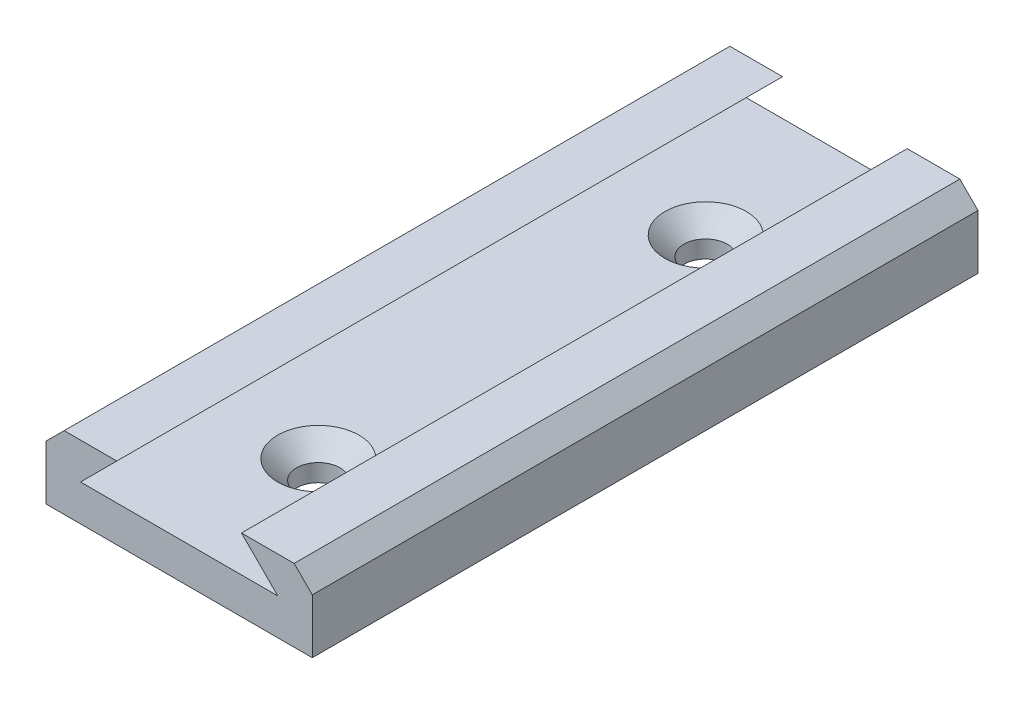
from build123d import *

# Parameters (mm, degrees)
BOSS_EXTRUDE1_DEPTH                          = 55
CSK_FOR_M3_HEX_SOCKET_COUNTERSUNK_CA_2_COUNT = 2
CSK_FOR_M3_HEX_SOCKET_COUNTERSUNK_CA_2_PITCH = 32


with BuildPart() as part:
    # Sketch2 → Boss-Extrude1 (new body)
    with BuildSketch(Plane.XY):
        Polygon((-11, 0), (11, 0), (11, 4.5), (9.5, 6), (5.15, 6), (8.15, 3), (-8.15, 3), (-5.15, 6), (-9.5, 6), (-11, 4.5), align=None)
    extrude(amount=BOSS_EXTRUDE1_DEPTH)

    # Sketch4 → CSK for M3 Hex Socket Countersunk Cap Screw1 (revolve, cut)
    with BuildSketch(Plane(origin=(0, 3, 11.5), x_dir=(0, 0, 1), z_dir=(1, 0, 0))):
        Polygon((0, 0), (0, 3), (1.8, 3), (1.8, 1.56), (3.36, 0), align=None)
    csk_for_m3_hex_socket_countersunk_cap_sc = revolve(axis=Axis((0, 9.35, 11.5), (0, -1, 0)), mode=Mode.SUBTRACT)

    # CSK for M3 Hex Socket Countersunk Ca 2: CSK for M3 Hex Socket Countersunk Cap Screw1 ×2
    with Locations(*[(0, 0, i * CSK_FOR_M3_HEX_SOCKET_COUNTERSUNK_CA_2_PITCH) for i in range(1, CSK_FOR_M3_HEX_SOCKET_COUNTERSUNK_CA_2_COUNT)]):
        add(csk_for_m3_hex_socket_countersunk_cap_sc, mode=Mode.SUBTRACT)


solid = part.part
